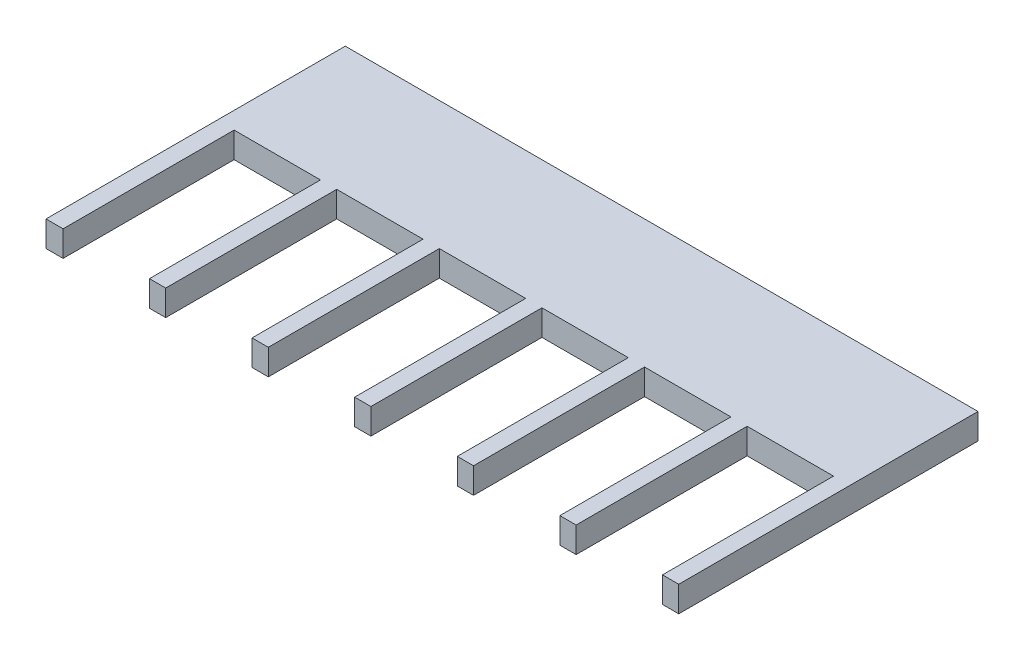
from build123d import *

# Parameters (mm, degrees)
BOSS_EXTRUDE1_DEPTH = 3


with BuildPart() as part:
    # Sketch1 → Boss-Extrude1 (new body)
    with BuildSketch(Plane(origin=(0, 0, 0), x_dir=(1, 0, 0), z_dir=(0, 1, 0))):
        Polygon((2, -35), (2, -15), (7.05, -15), (12.1, -15), (12.1, -35), (14, -35), (14, -15), (19.05, -15), (24.1, -15), (24.1, -35), (26, -35), (26, -15), (31.05, -15), (36.1, -15), (36.1, -35), (38, -35), (38, -15), (43.05, -15), (48.1, -15), (48.1, -35), (50, -35), (50, -15), (55.05, -15), (60.1, -15), (60.1, -35), (62, -35), (62, -15), (67.05, -15), (72.1, -15), (72.1, -35), (74, -35), (74, 0), (0, 0), (0, -35), align=None)
    extrude(amount=BOSS_EXTRUDE1_DEPTH)


solid = part.part
